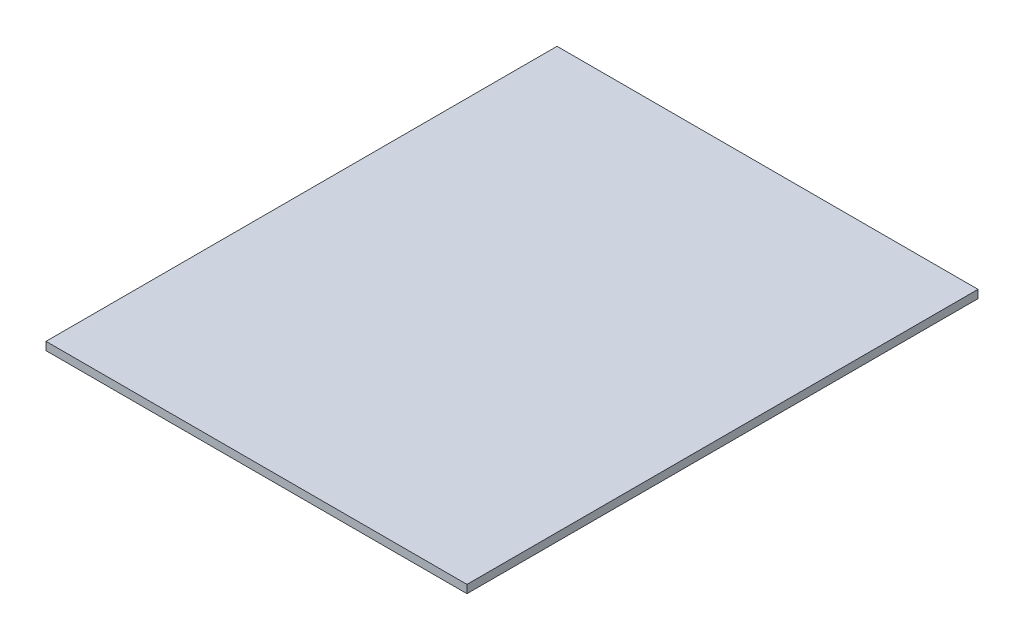
from build123d import *

# Parameters (mm, degrees)
SKETCH1_W            = 624
SKETCH1_H            = 12
DET2_RAF_ALT_1_DEPTH = 757.5


with BuildPart() as part:
    # Sketch1 → DET2_raf_alt_1 (new body)
    with BuildSketch(Plane.XY):
        with Locations((1026, 1503)):
            Rectangle(SKETCH1_W, SKETCH1_H)
    extrude(amount=-DET2_RAF_ALT_1_DEPTH)


solid = part.part
